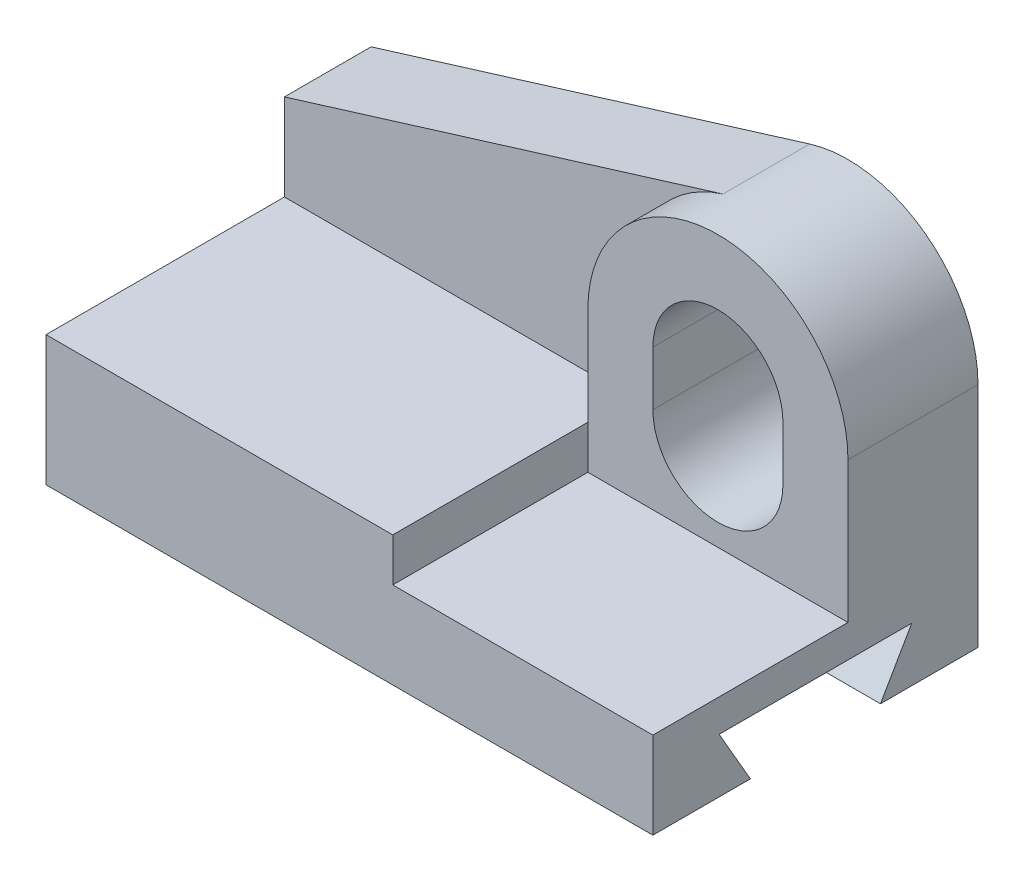
from build123d import *

# Parameters (mm, degrees)
SKETCH_1_W          = 56
SKETCH_1_H          = 30
EXTRUDE_1_DEPTH     = 8
SKETCH_2_W          = 32
SKETCH_2_H          = 30
EXTRUDE_2_DEPTH     = 4
CUT_EXTRUDE_1_DEPTH = 60.203040462
EXTRUDE_3_DEPTH     = 12
EXTRUDE_4_DEPTH     = 8


with BuildPart() as part:
    # 草图1 → 凸台-拉伸1 (new body)
    with BuildSketch(Plane(origin=(0, 0, 0), x_dir=(1, 0, 0), z_dir=(0, 1, 0))):
        Rectangle(SKETCH_1_W, SKETCH_1_H)
    extrude(amount=EXTRUDE_1_DEPTH)

    # 草图2 → 凸台-拉伸2 (add)
    with BuildSketch(Plane(origin=(0, 8, 0), x_dir=(1, 0, 0), z_dir=(0, 1, 0))):
        with Locations((-12, 0)):
            Rectangle(SKETCH_2_W, SKETCH_2_H)
    extrude(amount=EXTRUDE_2_DEPTH)

    # 草图3 → 切除-拉伸1 (cut, through all)
    with BuildSketch(Plane.ZY.offset(28)):
        Polygon((-6, 0), (6, 0), (8.886751346, 5), (-8.886751346, 5), align=None)
    extrude(amount=-CUT_EXTRUDE_1_DEPTH, mode=Mode.SUBTRACT)

    # 草图4 → 凸台-拉伸3 (add)
    with BuildSketch(Plane.XY.offset(-15)):
        with BuildLine():
            Line((28, 8), (28, 21))
            ThreePointArc((28, 21), (16, 33), (4, 21))
            Line((4, 21), (4, 8))
            Line((4, 8), (28, 8))
        make_face()
        with BuildLine():
            Line((10, 21), (10, 16))
            ThreePointArc((10, 16), (16, 10), (22, 16))
            Line((22, 16), (22, 21))
            ThreePointArc((22, 21), (16, 27), (10, 21))
        make_face(mode=Mode.SUBTRACT)
    extrude(amount=EXTRUDE_3_DEPTH)

    # 草图5 → 凸台-拉伸4 (add)
    with BuildSketch(Plane.XY.offset(-15)):
        with BuildLine():
            Line((-28, 12), (-28, 20))
            Line((-28, 20), (12.466636051, 32.468013743))
            ThreePointArc((12.466636051, 32.468013743), (6.345975777, 28.127398986), (4, 21))
            Line((4, 21), (4, 12))
            Line((4, 12), (-28, 12))
        make_face()
    extrude(amount=EXTRUDE_4_DEPTH)


solid = part.part
